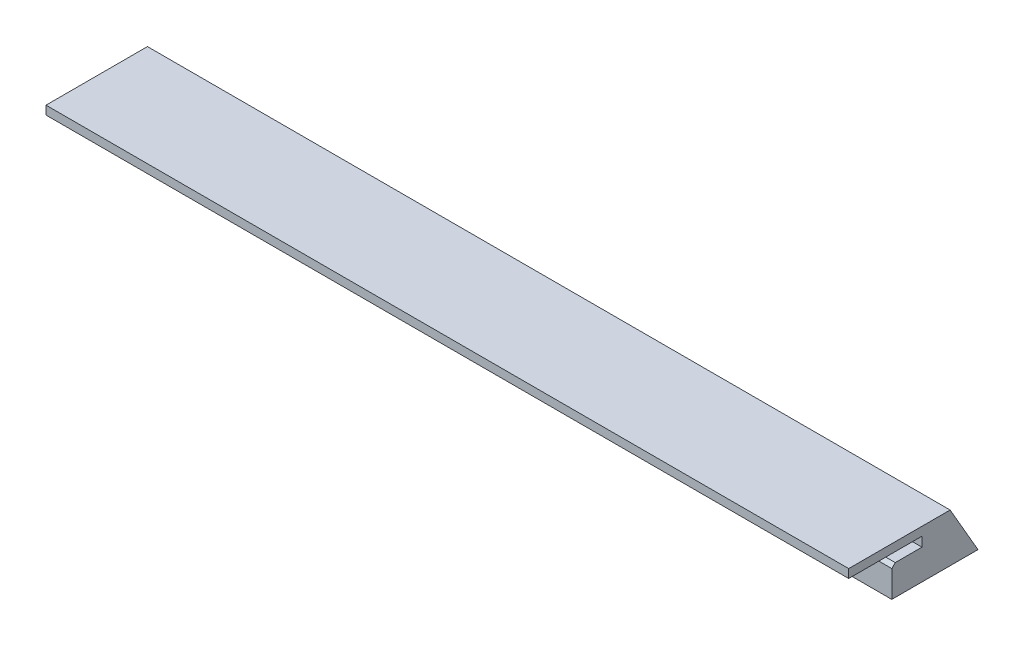
from build123d import *

# Parameters (mm, degrees)
SKETCH_2_W                  = 93.1
SKETCH_2_H                  = 10
EXTRUDE_1_DEPTH             = 3.5
SKETCH_4_W                  = 93.1
SKETCH_4_H                  = 6.5
EXTRUDE_2_DEPTH             = 1.1
SKETCH_5_W                  = 93.1
SKETCH_5_H                  = 10
EXTRUDE_3_DEPTH             = 2
CUT_EXTRUDE_1_DEPTH         = 94.867832616
SKETCH_7_W                  = 83.1
SKETCH_7_H                  = 1.1
EXTRUDE_4_DEPTH             = 3.5
CHAMFER_1_SIZE              = 0.4
CUT_EXTRUDE_2_REACH         = 95.868
SKETCH_8_R                  = 150
SKETCH_9_W                  = 93.1
SKETCH_9_H                  = 2
EXTRUDE_5_DEPTH             = 5
EXTRUDE_5_DIRECTION_2_REACH = 95.868
CUT_EXTRUDE_3_REACH         = 95.868
SKETCH_10_W                 = 11.766838493
SKETCH_10_H                 = 1


with BuildPart() as part:
    # 草图2 → 凸台-拉伸1 (new body)
    with BuildSketch(Plane(origin=(0, 0, 0), x_dir=(1, 0, 0), z_dir=(0, 1, 0))):
        with Locations((46.55, 5)):
            Rectangle(SKETCH_2_W, SKETCH_2_H)
    extrude(amount=EXTRUDE_1_DEPTH)

    # 草图4 → 凸台-拉伸2 (add)
    with BuildSketch(Plane(origin=(0, 3.5, 0), x_dir=(1, 0, 0), z_dir=(0, 1, 0))):
        with Locations((46.55, 6.75)):
            Rectangle(SKETCH_4_W, SKETCH_4_H)
    extrude(amount=EXTRUDE_2_DEPTH)

    # 草图5 → 凸台-拉伸3 (add)
    with BuildSketch(Plane(origin=(0, 4.6, 0), x_dir=(1, 0, 0), z_dir=(0, 1, 0))):
        with Locations((46.55, 5)):
            Rectangle(SKETCH_5_W, SKETCH_5_H)
    extrude(amount=EXTRUDE_3_DEPTH)

    # 草图6 → 切除-拉伸1 (cut, through all)
    with BuildSketch(Plane.ZY):
        Polygon((-10, 0), (-6.189488223, 6.6), (-10, 6.6), align=None)
    extrude(amount=-CUT_EXTRUDE_1_DEPTH, mode=Mode.SUBTRACT)

    # 草图7 → 凸台-拉伸4 (add)
    with BuildSketch(Plane.XY.offset(-3.5)):
        with Locations((46.55, 4.05)):
            Rectangle(SKETCH_7_W, SKETCH_7_H)
    extrude(amount=EXTRUDE_4_DEPTH)

    # 倒角1
    chamfer_1_edges = [part.edges().sort_by_distance(p)[0] for p in [
        (90.6, 3.5, 0),
        (2.5, 3.5, 0),
    ]]
    chamfer(chamfer_1_edges, length=CHAMFER_1_SIZE)

    # 草图8 → 切除-拉伸2 (cut, up to next)
    with BuildSketch(Plane.XZ, mode=Mode.PRIVATE) as cut_extrude_2_sk1:
        with Locations((46.55, 147)):
            Circle(SKETCH_8_R)
    cut_extrude_2_tool1 = extrude(cut_extrude_2_sk1.sketch, amount=-CUT_EXTRUDE_2_REACH, mode=Mode.PRIVATE) & part.part
    add(cut_extrude_2_tool1.solids().sort_by_distance((46.55, 0, 147))[0], mode=Mode.SUBTRACT)

    # 草图9 → 凸台-拉伸5 (add)
    with BuildSketch(Plane.XY):
        with Locations((46.55, 5.6)):
            Rectangle(SKETCH_9_W, SKETCH_9_H)
    extrude(amount=EXTRUDE_5_DEPTH)

    # 草图9 → 凸台-拉伸5 direction 2 (add, up to next)
    with BuildSketch(Plane.XY, mode=Mode.PRIVATE) as extrude_5_direction_2_sk1:
        with Locations((46.55, 5.6)):
            Rectangle(SKETCH_9_W, SKETCH_9_H)
    extrude_5_direction_2_tool1 = extrude(extrude_5_direction_2_sk1.sketch, amount=-EXTRUDE_5_DIRECTION_2_REACH, mode=Mode.PRIVATE) - part.part
    add(extrude_5_direction_2_tool1.solids().sort_by_distance((46.55, 5.6, 0))[0])

    # 草图10 → 切除-拉伸3 (cut, up to next)
    with BuildSketch(Plane(origin=(93.1, 0, 0), x_dir=(0, 0, -1), z_dir=(1, 0, 0)), mode=Mode.PRIVATE) as cut_extrude_3_sk1:
        with Locations((0.883419247, 6.1)):
            Rectangle(SKETCH_10_W, SKETCH_10_H)
    cut_extrude_3_tool1 = extrude(cut_extrude_3_sk1.sketch, amount=-CUT_EXTRUDE_3_REACH, mode=Mode.PRIVATE) & part.part
    add(cut_extrude_3_tool1.solids().sort_by_distance((93.1, 6.1, -0.883419))[0], mode=Mode.SUBTRACT)


solid = part.part
